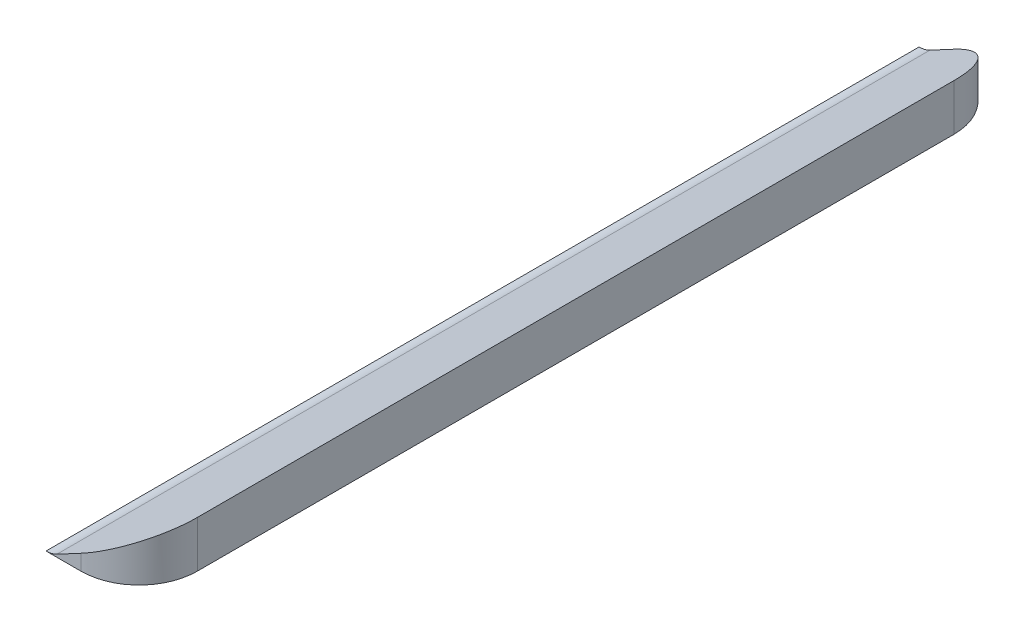
from build123d import *

# Parameters (mm, degrees)
SKETCH1_W              = 40
SKETCH1_H              = 200
BOSS_EXTRUDE1_DEPTH    = 10
SKETCH2_W              = 15
SKETCH2_H              = 150
BOSS_EXTRUDE2_DEPTH    = 8
FILLET1_R              = 10
CUT_EXTRUDE1_DEPTH     = 205.753510348
FILLET2_R              = 4
SPLIT1_SURFACE_1_BACK  = 205.754
SPLIT1_SURFACE_1_DEPTH = 411.508


with BuildPart() as part:
    # Sketch1 → Boss-Extrude1 (new body)
    with BuildSketch(Plane(origin=(0, 0, 0), x_dir=(1, 0, 0), z_dir=(0, 1, 0))):
        with Locations((20, 100)):
            Rectangle(SKETCH1_W, SKETCH1_H)
    extrude(amount=BOSS_EXTRUDE1_DEPTH)

    # Sketch2 → Boss-Extrude2 (add)
    with BuildSketch(Plane(origin=(0, 10, 0), x_dir=(1, 0, 0), z_dir=(0, 1, 0))):
        with Locations((20, 100)):
            Rectangle(SKETCH2_W, SKETCH2_H)
    extrude(amount=BOSS_EXTRUDE2_DEPTH)

    # Fillet1
    fillet1_edges = [part.edges().sort_by_distance(p)[0] for p in [
        (27.5, 14, -25),
        (27.5, 14, -175),
    ]]
    fillet(fillet1_edges, radius=FILLET1_R)

    # Sketch3 → Cut-Extrude1 (cut, through all)
    with BuildSketch(Plane.XY):
        Polygon((27.5, 18), (12.5, 18), (12.5, 10), align=None)
    extrude(amount=-CUT_EXTRUDE1_DEPTH, mode=Mode.SUBTRACT)

    # Fillet2
    fillet2_edges = [part.edges().sort_by_distance(p)[0] for p in [
        (12.5, 10, -100),
    ]]
    fillet(fillet2_edges, radius=FILLET2_R)

    # Split1: cut with a surface, the side it looks to stays
    # Split1 surface: a surface, the sketch's curves swept straight by 411.508 mm
    with BuildLine(Plane.XY.offset(-SPLIT1_SURFACE_1_BACK), mode=Mode.PRIVATE) as split1_surface_1_path:
        Line((0, 10), (40, 10))
    split1_surface_1 = Shell.extrude(split1_surface_1_path.wire(), (0 * SPLIT1_SURFACE_1_DEPTH, 0 * SPLIT1_SURFACE_1_DEPTH, 1 * SPLIT1_SURFACE_1_DEPTH))
    split(bisect_by=split1_surface_1, keep=Keep.TOP)


solid = part.part
